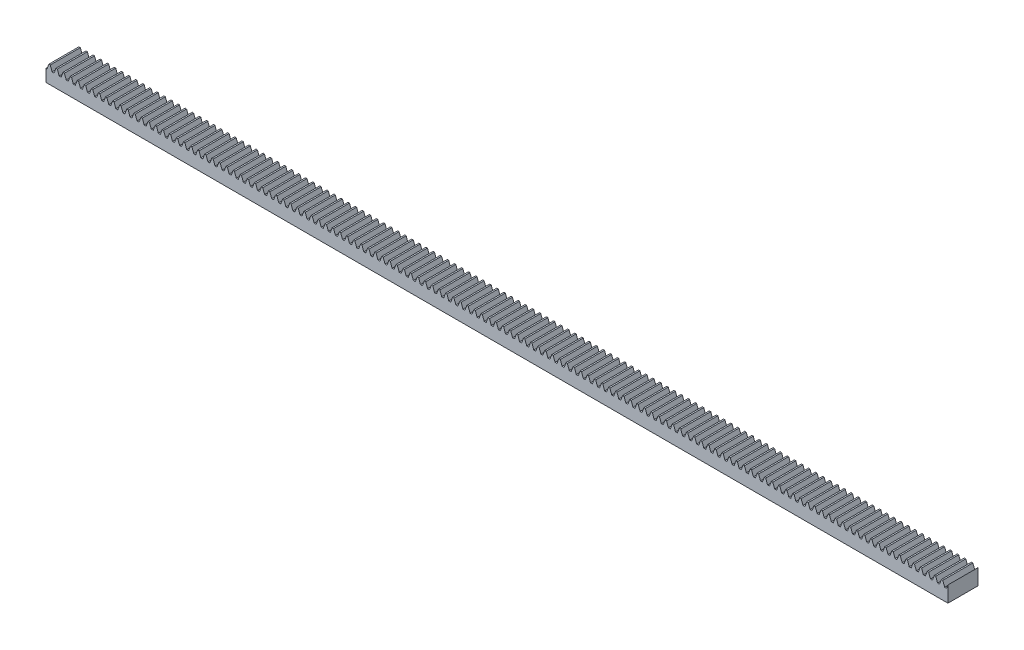
from build123d import *

# Parameters (mm, degrees)
BLANKSKE_W        = 600
BLANKSKE_H        = 11.5
BLANK_DEPTH       = 20
TOOTHCUTSIM_DEPTH = 601.443377847
TEETHCUTS_COUNT   = 129
TEETHCUTS_PITCH   = 4.712388975


with BuildPart() as part:
    # BlankSke → Blank (new body)
    with BuildSketch(Plane.XY):
        with Locations((300, 5.75)):
            Rectangle(BLANKSKE_W, BLANKSKE_H)
    extrude(amount=-BLANK_DEPTH)

    # TooCutSkeSim → ToothCutSim (cut, through all)
    with BuildSketch(Plane.XY):
        Polygon((0.654653055, 8.125), (-0.654653055, 8.125), (-1.892297439, 11.5254), (1.892297439, 11.5254), align=None)
    toothcutsim = extrude(amount=-TOOTHCUTSIM_DEPTH, mode=Mode.SUBTRACT)

    # TeethCuts: ToothCutSim ×129
    with Locations(*[(i * TEETHCUTS_PITCH, 0, 0) for i in range(1, TEETHCUTS_COUNT)]):
        add(toothcutsim, mode=Mode.SUBTRACT)


solid = part.part
